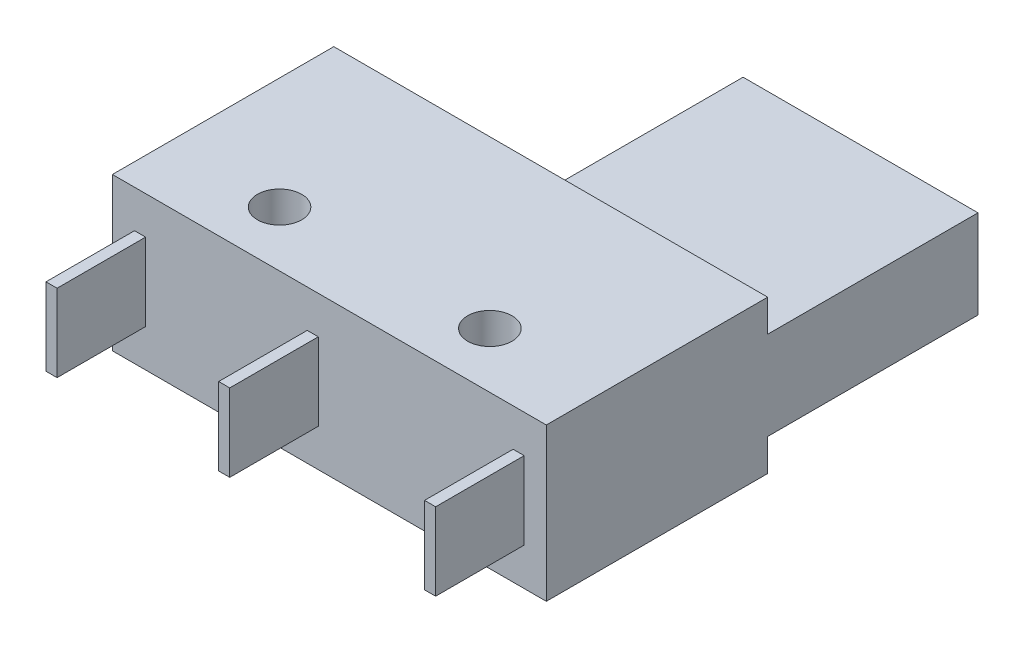
from build123d import *

# Parameters (mm, degrees)
SKETCH1_W           = 19.6
SKETCH1_H           = 10
BOSS_EXTRUDE1_DEPTH = 6.9
SKETCH2_W           = 0.5
SKETCH2_H           = 3.5
BOSS_EXTRUDE2_DEPTH = 4
SKETCH3_W           = 10.611233712
SKETCH3_H           = 4
BOSS_EXTRUDE3_DEPTH = 9.5
SKETCH5_R           = 1
CUT_EXTRUDE1_DEPTH  = 29.495964627


with BuildPart() as part:
    # Sketch1 → Boss-Extrude1 (new body)
    with BuildSketch(Plane(origin=(0, 0, 0), x_dir=(1, 0, 0), z_dir=(0, 1, 0))):
        with Locations((9.8, 5)):
            Rectangle(SKETCH1_W, SKETCH1_H)
    extrude(amount=BOSS_EXTRUDE1_DEPTH)

    # Sketch2 → Boss-Extrude2 (add)
    with BuildSketch(Plane.XY):
        with Locations((1.25, 3.45)):
            Rectangle(SKETCH2_W, SKETCH2_H)
        with Locations((9.05, 3.45)):
            Rectangle(SKETCH2_W, SKETCH2_H)
        with Locations((18.35, 3.45)):
            Rectangle(SKETCH2_W, SKETCH2_H)
    extrude(amount=BOSS_EXTRUDE2_DEPTH)

    # Sketch3 → Boss-Extrude3 (add)
    with BuildSketch(Plane(origin=(0, 0, -10), x_dir=(-1, 0, 0), z_dir=(0, 0, -1))):
        with Locations((-14.294383144, 3.45)):
            Rectangle(SKETCH3_W, SKETCH3_H)
    extrude(amount=BOSS_EXTRUDE3_DEPTH)

    # Sketch5 → Cut-Extrude1 (cut, through all)
    with BuildSketch(Plane(origin=(0, 6.9, 0), x_dir=(1, 0, 0), z_dir=(0, 1, 0))):
        with Locations(Location((5.05, 2.5, 0), (0, 0, 270))):
            Circle(SKETCH5_R)
        with Locations(Location((14.55, 2.5, 0), (0, 0, 270))):
            Circle(SKETCH5_R)
    extrude(amount=-CUT_EXTRUDE1_DEPTH, mode=Mode.SUBTRACT)


solid = part.part
